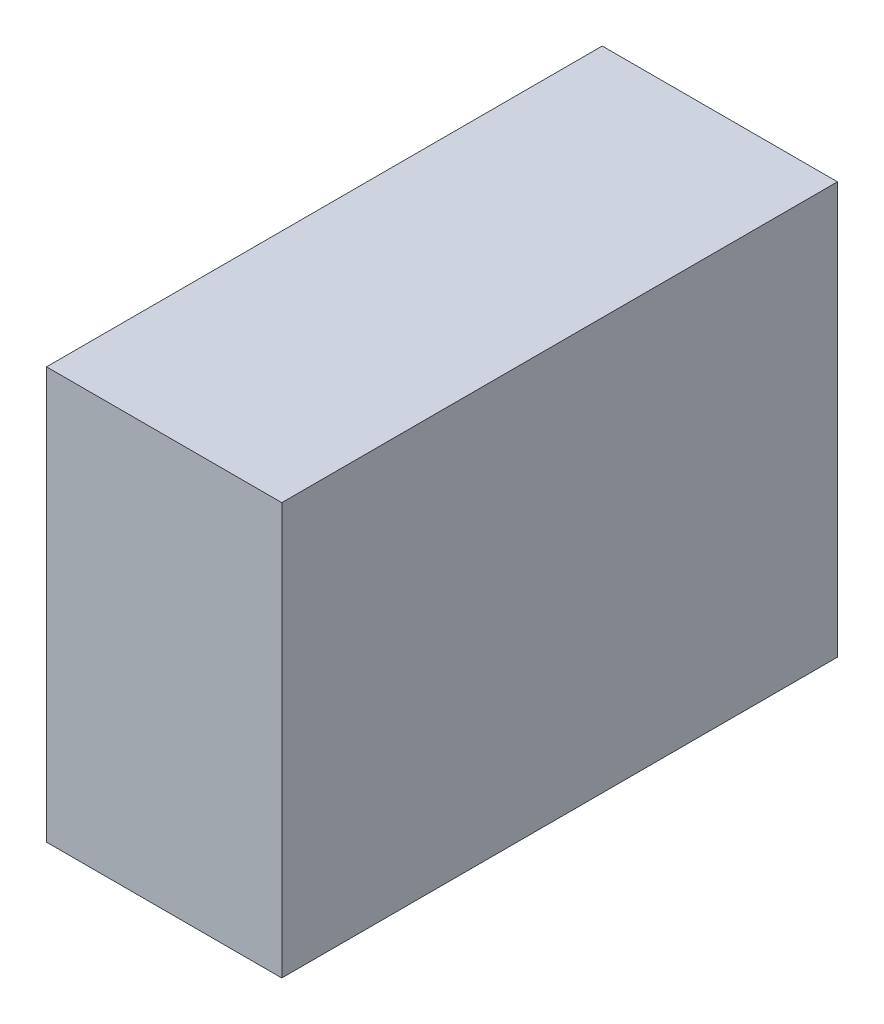
from build123d import *

# Parameters (mm, degrees)
SKETCH1_W           = 25.4
SKETCH1_H           = 44.45
BOSS_EXTRUDE1_DEPTH = 60


with BuildPart() as part:
    # Sketch1 → Boss-Extrude1 (new body)
    with BuildSketch(Plane.XY):
        Rectangle(SKETCH1_W, SKETCH1_H)
    extrude(amount=BOSS_EXTRUDE1_DEPTH)


solid = part.part
